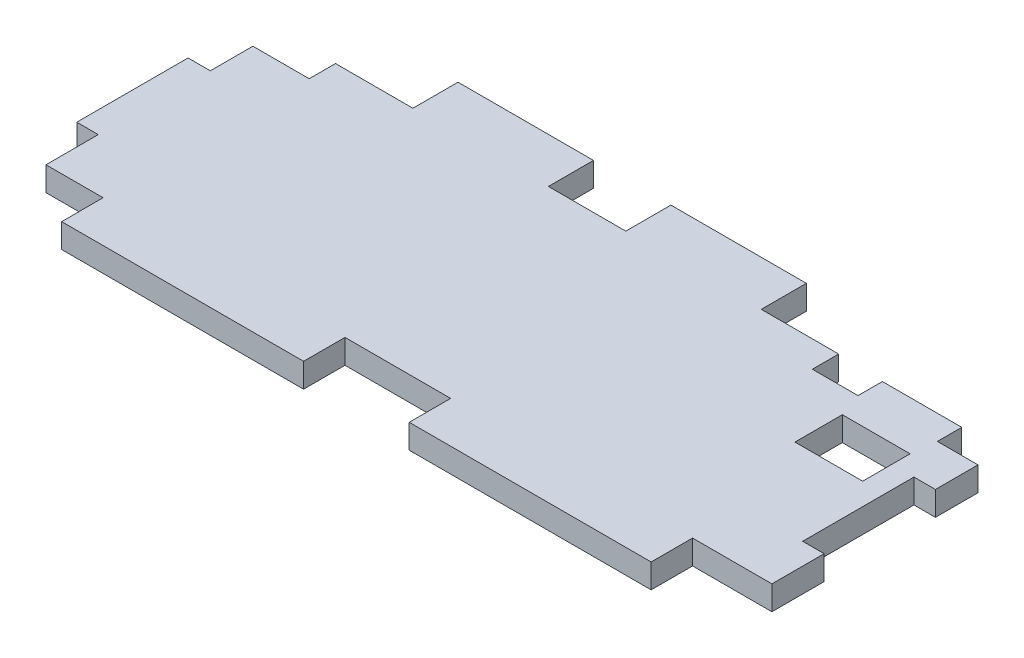
from build123d import *

# Parameters (mm, degrees)
BOSS_EXTRUDE2_DEPTH = 1.5875
SKETCH2_W           = 8.89
SKETCH2_H           = 6.223
CUT_EXTRUDE1_DEPTH  = 3.175
SKETCH4_W           = 7.3914
SKETCH4_H           = 1.27
SKETCH4_W_2         = 5.9944
SKETCH4_W_3         = 5.334
CUT_EXTRUDE2_DEPTH  = 57.051741709
SKETCH5_W           = 10.414
SKETCH5_H           = 0.635
SKETCH5_W_2         = 10.16
SKETCH5_H_2         = 0.7366
CUT_EXTRUDE3_DEPTH  = 57.051741709
SKETCH6_W           = 17.78
SKETCH6_H           = 0.254
CUT_EXTRUDE4_DEPTH  = 57.051741709
SKETCH7_W           = 10.414
SKETCH7_H           = 0.254
CUT_EXTRUDE5_DEPTH  = 56.950188363


with BuildPart() as part:
    # Sketch1 → Boss-Extrude2 (new, symmetric)
    with BuildSketch(Plane(origin=(0, 0, 0), x_dir=(1, 0, 0), z_dir=(0, 1, 0))):
        Polygon((-30.7594, 22.5171), (-30.7594, 17.0815), (-40.9194, 17.0815), (-40.9194, 14.1605), (-48.3108, 14.1605), (-48.3108, 7.3025), (-51.2318, 7.3025), (-51.2318, 0), (-51.2318, -7.3025), (-48.4124, -7.3025), (-48.4124, -14.1605), (-40.9194, -14.1605), (-40.9194, -19.5961), (-9.1694, -19.5961), (-9.1694, -14.1605), (4.699, -14.1605), (4.699, -19.5961), (36.449, -19.5961), (36.449, -14.1605), (46.863, -14.1605), (46.863, -7.3025), (44.0436, -7.3025), (44.0436, 0), (44.0436, 7.3025), (46.863, 7.3025), (46.863, 14.1605), (41.529, 14.1605), (41.529, 16.9799), (31.115, 16.9799), (31.115, 14.1605), (25.1206, 14.1605), (25.1206, 17.0815), (14.9606, 17.0815), (14.9606, 22.5171), (-2.8194, 22.5171), (-2.8194, 17.0815), (-12.9794, 17.0815), (-12.9794, 22.5171), align=None)
    extrude(amount=BOSS_EXTRUDE2_DEPTH, both=True)

    # Sketch2 → Cut-Extrude1 (cut)
    with BuildSketch(Plane(origin=(0, 1.5875, 0), x_dir=(1, 0, 0), z_dir=(0, 1, 0))):
        with Locations((36.703, 6.5786)):
            Rectangle(SKETCH2_W, SKETCH2_H)
    extrude(amount=-CUT_EXTRUDE1_DEPTH, mode=Mode.SUBTRACT)

    # Sketch4 → Cut-Extrude2 (cut, through all)
    with BuildSketch(Plane(origin=(0, 1.5875, 0), x_dir=(1, 0, 0), z_dir=(0, 1, 0))):
        with Locations((-44.6151, 13.5255)):
            Rectangle(SKETCH4_W, SKETCH4_H)
        with Locations((28.1178, 13.5255)):
            Rectangle(SKETCH4_W_2, SKETCH4_H)
        with Locations((44.196, 13.5255)):
            Rectangle(SKETCH4_W_3, SKETCH4_H)
    extrude(amount=-CUT_EXTRUDE2_DEPTH, mode=Mode.SUBTRACT)

    # Sketch5 → Cut-Extrude3 (cut, through all)
    with BuildSketch(Plane.XZ.offset(1.5875)):
        with Locations((36.322, -16.6624)):
            Rectangle(SKETCH5_W, SKETCH5_H)
        with Locations((20.0406, -16.7132)):
            Rectangle(SKETCH5_W_2, SKETCH5_H_2)
        with Locations((-7.8994, -16.7132)):
            Rectangle(SKETCH5_W_2, SKETCH5_H_2)
        with Locations((-35.8394, -16.7132)):
            Rectangle(SKETCH5_W_2, SKETCH5_H_2)
    extrude(amount=-CUT_EXTRUDE3_DEPTH, mode=Mode.SUBTRACT)

    # Sketch6 → Cut-Extrude4 (cut, through all)
    with BuildSketch(Plane.XZ.offset(1.5875)):
        with Locations((6.0706, -22.3901)):
            Rectangle(SKETCH6_W, SKETCH6_H)
        with Locations((-21.8694, -22.3901)):
            Rectangle(SKETCH6_W, SKETCH6_H)
    extrude(amount=-CUT_EXTRUDE4_DEPTH, mode=Mode.SUBTRACT)

    # Sketch7 → Cut-Extrude5 (cut, through all)
    with BuildSketch(Plane.XZ.offset(1.5875)):
        with Locations((36.322, -16.2179)):
            Rectangle(SKETCH7_W, SKETCH7_H)
    extrude(amount=-CUT_EXTRUDE5_DEPTH, mode=Mode.SUBTRACT)


solid = part.part
